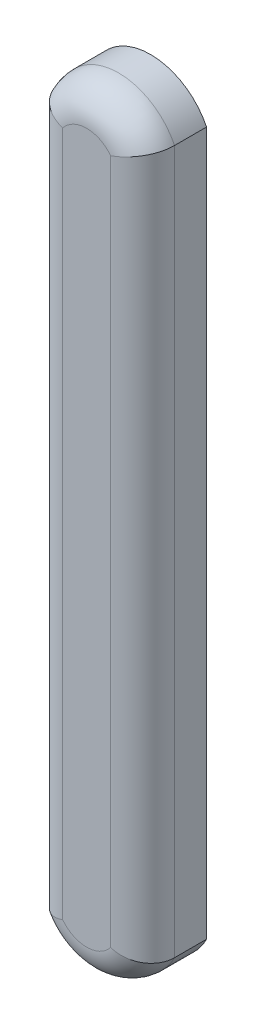
from build123d import *

# Parameters (mm, degrees)
BOSS_EXTRU_1_DEPTH = 0.2
CONG_1_R           = 0.1


with BuildPart() as part:
    # Esquisse1 → Boss.-Extru.1 (new body)
    with BuildSketch(Plane.XY):
        with BuildLine():
            Line((0, 0), (0, 2.2))
            ThreePointArc((0, 2.2), (0.175, 2.309006611), (0.35, 2.2))
            Line((0.35, 2.2), (0.35, 0))
            ThreePointArc((0.35, 0), (0.175, -0.109006611), (0, 0))
        make_face()
    extrude(amount=BOSS_EXTRU_1_DEPTH)

    # Congé1
    cong_1_edges = [part.edges().sort_by_distance(p)[0] for p in [
        (0.175, 2.309006611, 0.2),
        (0, 1.1, 0.2),
        (0.175, -0.109006611, 0.2),
        (0.35, 1.1, 0.2),
    ]]
    fillet(cong_1_edges, radius=CONG_1_R)


solid = part.part
